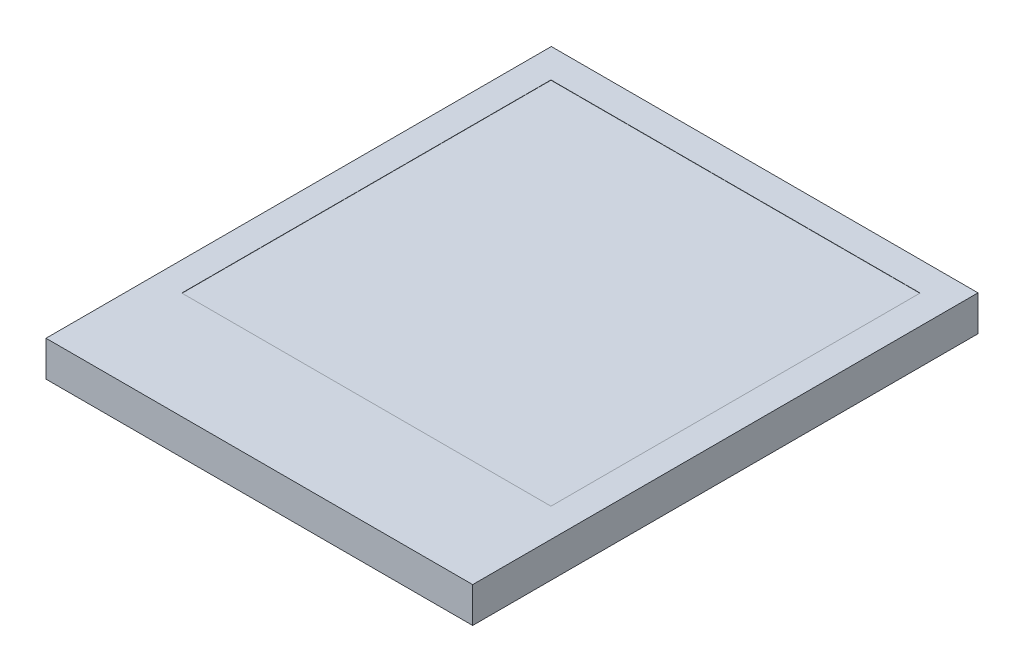
from build123d import *

# Parameters (mm, degrees)
SKETCH_1_W          = 17.58
SKETCH_1_H          = 20.82
EXTRUDE_1_DEPTH     = 1.46
SKETCH_2_W          = 15.21
SKETCH_2_H          = 15.21
CUT_EXTRUDE_1_DEPTH = 0.01


with BuildPart() as part:
    # 草图1 → 凸台-拉伸1 (new body)
    with BuildSketch(Plane(origin=(0, 0, 0), x_dir=(1, 0, 0), z_dir=(0, 1, 0))):
        with Locations((8.79, 10.41)):
            Rectangle(SKETCH_1_W, SKETCH_1_H)
    extrude(amount=EXTRUDE_1_DEPTH)

    # 草图2 → 切除-拉伸1 (cut)
    with BuildSketch(Plane(origin=(0, 1.46, 0), x_dir=(1, 0, 0), z_dir=(0, 1, 0))):
        with Locations((8.79, 12.015)):
            Rectangle(SKETCH_2_W, SKETCH_2_H)
    extrude(amount=-CUT_EXTRUDE_1_DEPTH, mode=Mode.SUBTRACT)


solid = part.part
